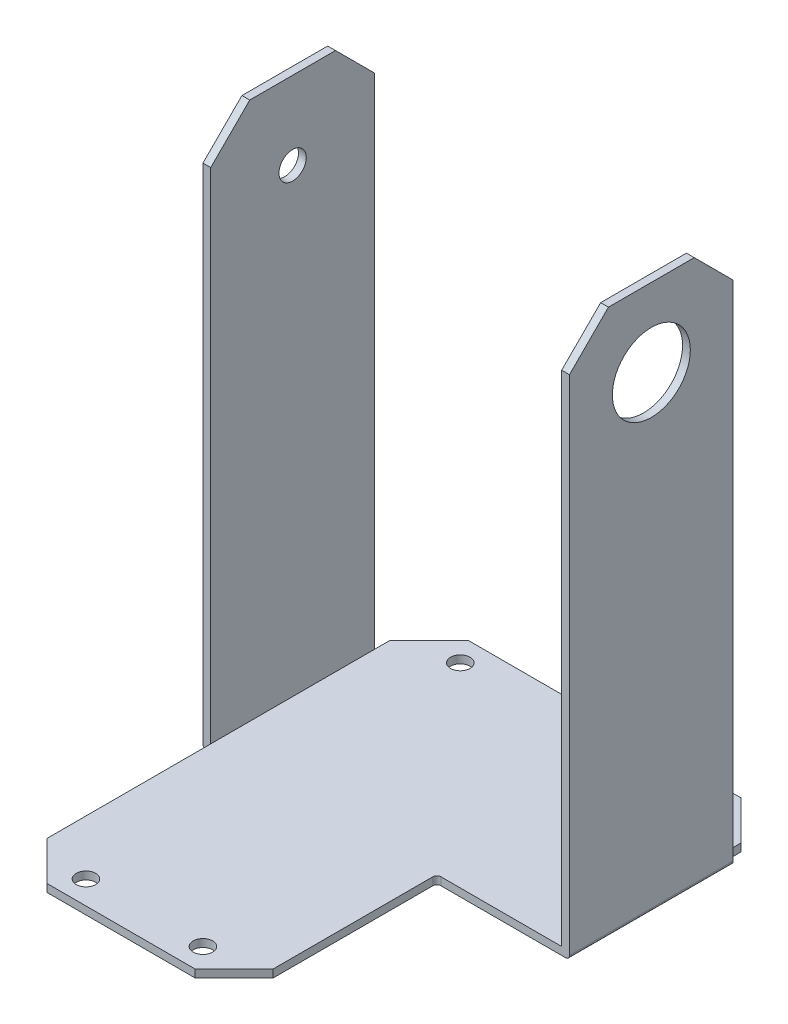
from build123d import *

# Parameters (mm, degrees)
SKETCH_1_W                  = 47
SKETCH_1_H                  = 21
EXTRUDE_1_DEPTH             = 70
SHELL_1_T                   = -1
SKETCH_2_W                  = 29
SKETCH_2_H                  = 1
EXTRUDE_2_DEPTH             = 26
SKETCH_3_W                  = 45
SKETCH_3_H                  = 1
EXTRUDE_3_DEPTH             = 7
HOLE_WIZARD_10_0_10_1_D     = 10
HOLE_WIZARD_10_0_10_1_DEPTH = 1
HOLE_WIZARD_3_5_3_5_1_D     = 3.5
HOLE_WIZARD_M3_1_D          = 2.5
CHAMFER_1_SIZE              = 5
FILLET_1_R                  = 0.5


with BuildPart() as part:
    # 草图1 → 凸台-拉伸1 (new body)
    with BuildSketch(Plane(origin=(0, 0, 0), x_dir=(1, 0, 0), z_dir=(0, 1, 0))):
        with Locations((-23.5, 10.5)):
            Rectangle(SKETCH_1_W, SKETCH_1_H)
    extrude(amount=EXTRUDE_1_DEPTH)

    # 抽壳1
    shell_1_openings = [part.faces().sort_by_distance(p)[0] for p in [
        (-23.5, 70, -10.5),
        (-23.5, 35, 0),
        (-23.5, 35, -21),
    ]]
    offset(amount=SHELL_1_T, openings=shell_1_openings, kind=Kind.INTERSECTION)

    # 草图2 → 凸台-拉伸2 (add)
    with BuildSketch(Plane.XY):
        with Locations((-31.5, 0.5)):
            Rectangle(SKETCH_2_W, SKETCH_2_H)
    extrude(amount=EXTRUDE_2_DEPTH)

    # 草图3 → 凸台-拉伸3 (add)
    with BuildSketch(Plane(origin=(0, 0, -21), x_dir=(-1, 0, 0), z_dir=(0, 0, -1))):
        with Locations((23.5, 0.5)):
            Rectangle(SKETCH_3_W, SKETCH_3_H)
    extrude(amount=EXTRUDE_3_DEPTH)

    # Ø10.0 (10) 直径槽口1
    with Locations(Plane(origin=(0, 0, 0), x_dir=(0, 0, -1), z_dir=(1, 0, 0))):
        with Locations((10.5, 60)):
            Hole(HOLE_WIZARD_10_0_10_1_D / 2, depth=HOLE_WIZARD_10_0_10_1_DEPTH)

    # Ø3.5 (3.5) 直径槽口1 (through all)
    with Locations(Plane.ZY.offset(47)):
        with Locations((-10.5, 60)):
            Hole(HOLE_WIZARD_3_5_3_5_1_D / 2)

    # M3 螺纹孔1 (through all)
    with Locations(Plane(origin=(0, 1, 0), x_dir=(1, 0, 0), z_dir=(0, 1, 0))):
        with Locations((-39, -23), (-24, -23), (-24, 25), (-39, 25)):
            Hole(HOLE_WIZARD_M3_1_D / 2)

    # 倒角1
    chamfer_1_edges = [part.edges().sort_by_distance(p)[0] for p in [
        (-46.5, 70, 0),
        (-46.5, 70, -21),
        (-0.5, 70, 0),
        (-46, 0.5, 26),
        (-17, 0.5, 26),
        (-1, 0.5, -28),
        (-46, 0.5, -28),
        (-0.5, 70, -21),
    ]]
    chamfer(chamfer_1_edges, length=CHAMFER_1_SIZE)

    # 圆角1
    fillet_1_edges = [part.edges().sort_by_distance(p)[0] for p in [
        (-17, 0.5, 0),
        (-47, 0, -10.5),
        (0, 0, -10.5),
    ]]
    fillet(fillet_1_edges, radius=FILLET_1_R)


solid = part.part
